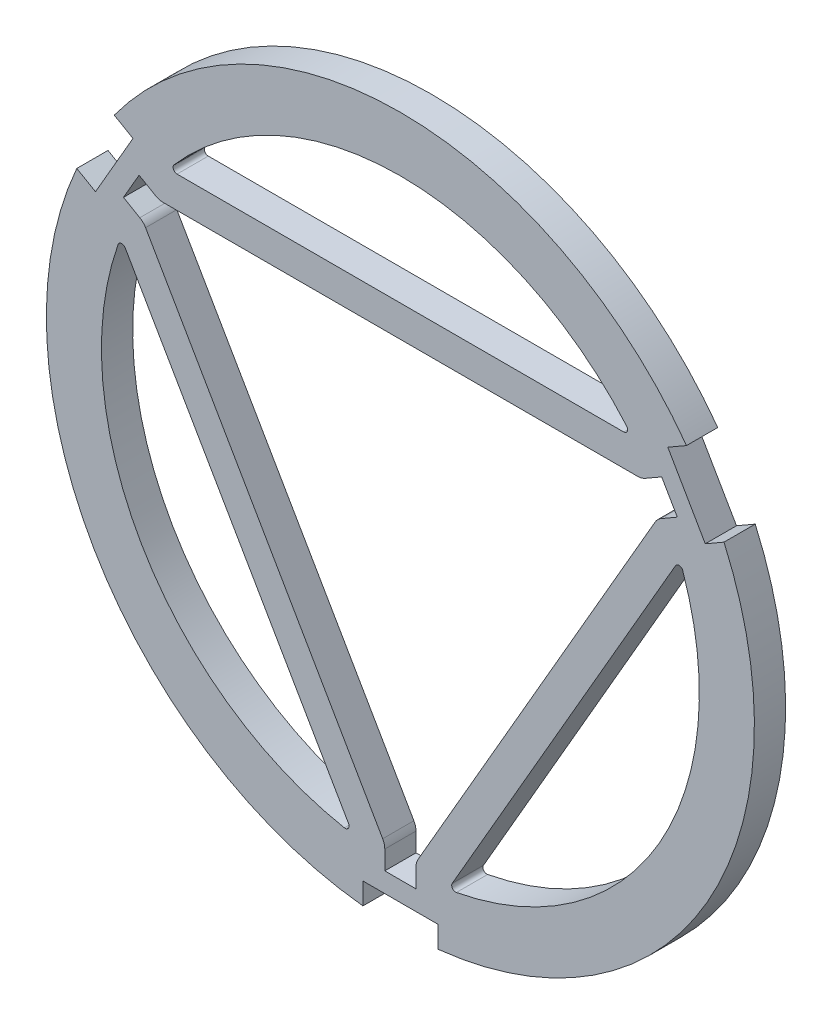
from build123d import *

# Parameters (mm, degrees)
BOSS_EXTRUDE1_DEPTH = 1.984375
FILLET1_R           = 0.25
FILLET2_R           = 1


with BuildPart() as part:
    # Sketch1 → Boss-Extrude1 (new body)
    with BuildSketch(Plane.XY):
        with BuildLine():
            Line((19.377158479, 8.437777007), (20.566763323, 9.124595684))
            ThreePointArc((20.566763323, 9.124595684), (19.485571585, -11.25), (2.38125, -22.373637354))
            Line((2.38125, -22.373637354), (2.38125, -21))
            Line((2.38125, -21), (-2.38125, -21))
            Line((-2.38125, -21), (-2.38125, -22.373637354))
            ThreePointArc((-2.38125, -22.373637354), (-19.485571585, -11.25), (-20.566763323, 9.124595684))
            Line((-20.566763323, 9.124595684), (-19.377158479, 8.437777007))
            Line((-19.377158479, 8.437777007), (-16.995908479, 12.562222993))
            Line((-16.995908479, 12.562222993), (-18.185513323, 13.24904167))
            ThreePointArc((-18.185513323, 13.24904167), (0, 22.5), (18.185513323, 13.24904167))
            Line((18.185513323, 13.24904167), (16.995908479, 12.562222993))
            Line((16.995908479, 12.562222993), (19.377158479, 8.437777007))
        make_face()
        with BuildLine():
            Line((-14.730919863, 12), (14.730919863, 12))
            ThreePointArc((14.730919863, 12), (0, 19), (-14.730919863, 12))
        make_face(mode=Mode.SUBTRACT)
        Polygon((-15.336133076, 10), (15.336133076, 10), (16.607907975, 10.73425958), (17.600095475, 9.01574042), (16.328320576, 8.281480839), (0.9921875, -18.281480839), (0.9921875, -19.75), (-0.9921875, -19.75), (-0.9921875, -18.281480839), (-16.328320576, 8.281480839), (-17.600095475, 9.01574042), (-16.607907975, 10.73425958), align=None, mode=Mode.SUBTRACT)
        with BuildLine():
            Line((-3.026844914, -18.757350822), (-17.757764777, 6.757350822))
            ThreePointArc((-17.757764777, 6.757350822), (-16.454482672, -9.5), (-3.026844914, -18.757350822))
        make_face(mode=Mode.SUBTRACT)
        with BuildLine():
            Line((17.757764777, 6.757350822), (3.026844914, -18.757350822))
            ThreePointArc((3.026844914, -18.757350822), (16.454482672, -9.5), (17.757764777, 6.757350822))
        make_face(mode=Mode.SUBTRACT)
    extrude(amount=BOSS_EXTRUDE1_DEPTH)

    # Fillet1
    fillet1_edges = [part.edges().sort_by_distance(p)[0] for p in [
        (14.730919863, 12, 0.9921875),
        (-14.730919863, 12, 0.9921875),
        (-17.757764777, 6.757350822, 0.9921875),
        (-3.026844914, -18.757350822, 0.9921875),
        (3.026844914, -18.757350822, 0.9921875),
        (17.757764777, 6.757350822, 0.9921875),
    ]]
    fillet(fillet1_edges, radius=FILLET1_R)

    # Fillet2
    fillet2_edges = [part.edges().sort_by_distance(p)[0] for p in [
        (15.336133076, 10, 0.9921875),
        (-15.336133076, 10, 0.9921875),
        (-16.328320576, 8.281480839, 0.9921875),
        (-0.9921875, -18.281480839, 0.9921875),
        (0.9921875, -18.281480839, 0.9921875),
        (16.328320576, 8.281480839, 0.9921875),
    ]]
    fillet(fillet2_edges, radius=FILLET2_R)


solid = part.part
